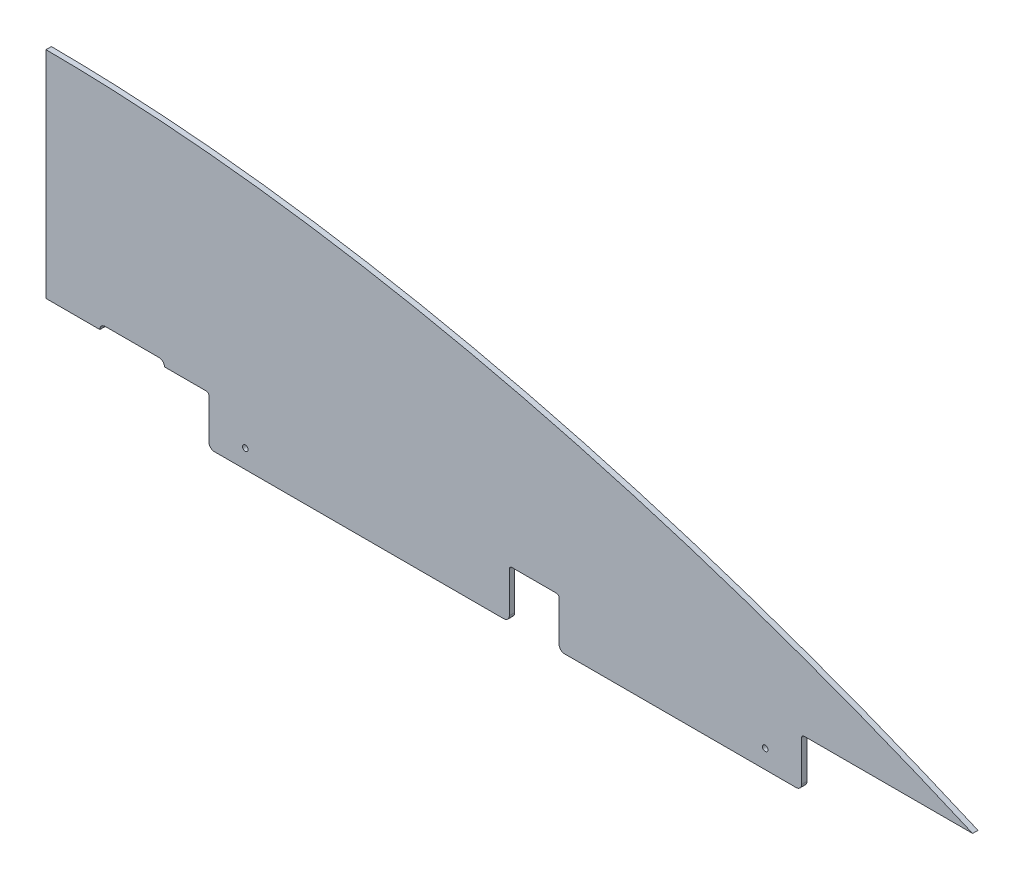
from build123d import *

# Parameters (mm, degrees)
BOSS_EXTRUDE1_DEPTH      = 6.35
CUT_EXTRUDE2_DEPTH       = 1122.363974261
SKETCH8_W                = 698.5
SKETCH8_H                = 57.15
BOSS_EXTRUDE3_DEPTH      = 6.35
SKETCH12_W               = 58.7375
SKETCH12_H               = 57.15
CUT_EXTRUDE3_DEPTH       = 1122.363974261
FILLET2_R                = 3.175
FILLET3_R                = 6.35
F_0_257_DIAMETER_HOLE2_D = 6.5278


with BuildPart() as part:
    # Sketch1 → Boss-Extrude1 (new body)
    with BuildSketch(Plane.XY):
        with BuildLine():
            Line((0, 254), (0, 0))
            Line((0, 0), (1092.2, 0))
            add(Edge.make_bspline(
                [(0, 254), (376.513153864, 252.276375478), (770.285770075, 140.499670678), (1092.2, 0)],
                knots=[0, 0, 0, 0, 1, 1, 1, 1], degree=3))
        make_face()
    extrude(amount=BOSS_EXTRUDE1_DEPTH)

    # Sketch7 → Cut-Extrude2 (cut, through all)
    with BuildSketch(Plane(origin=(0, 0, 0), x_dir=(-1, 0, 0), z_dir=(0, 0, -1))):
        with BuildLine():
            Line((-133.35, 0), (-63.5, 0))
            ThreePointArc((-63.5, 0), (-65.359871939, 4.490128061), (-69.85, 6.35))
            Line((-69.85, 6.35), (-133.35, 6.35))
            ThreePointArc((-133.35, 6.35), (-137.840128061, 4.490128061), (-139.7, 0))
            Line((-139.7, 0), (-133.35, 0))
        make_face()
    extrude(amount=-CUT_EXTRUDE2_DEPTH, mode=Mode.SUBTRACT)

    # Sketch8 → Boss-Extrude3 (add)
    with BuildSketch(Plane.XY.offset(6.35)):
        with Locations((541.3375, -28.575)):
            Rectangle(SKETCH8_W, SKETCH8_H)
    extrude(amount=-BOSS_EXTRUDE3_DEPTH)

    # Sketch12 → Cut-Extrude3 (cut, through all)
    with BuildSketch(Plane.XY.offset(6.35)):
        with Locations((575.46875, -28.575)):
            Rectangle(SKETCH12_W, SKETCH12_H)
    extrude(amount=-CUT_EXTRUDE3_DEPTH, mode=Mode.SUBTRACT)

    # Fillet2
    fillet2_edges = [part.edges().sort_by_distance(p)[0] for p in [
        (192.0875, 0, 3.175),
        (890.5875, 0, 3.175),
        (604.8375, 0, 3.175),
        (546.1, 0, 3.175),
    ]]
    fillet(fillet2_edges, radius=FILLET2_R)

    # Fillet3
    fillet3_edges = [part.edges().sort_by_distance(p)[0] for p in [
        (192.0875, -57.15, 3.175),
        (890.5875, -57.15, 3.175),
        (604.8375, -57.15, 3.175),
        (546.1, -57.15, 3.175),
    ]]
    fillet(fillet3_edges, radius=FILLET3_R)

    # F (0.257) Diameter Hole2 (through all)
    with Locations(Plane(origin=(0, 0, 0), x_dir=(-1, 0, 0), z_dir=(0, 0, -1))):
        with Locations((-847.725, -35.306), (-234.95, -35.306)):
            Hole(F_0_257_DIAMETER_HOLE2_D / 2)


solid = part.part
